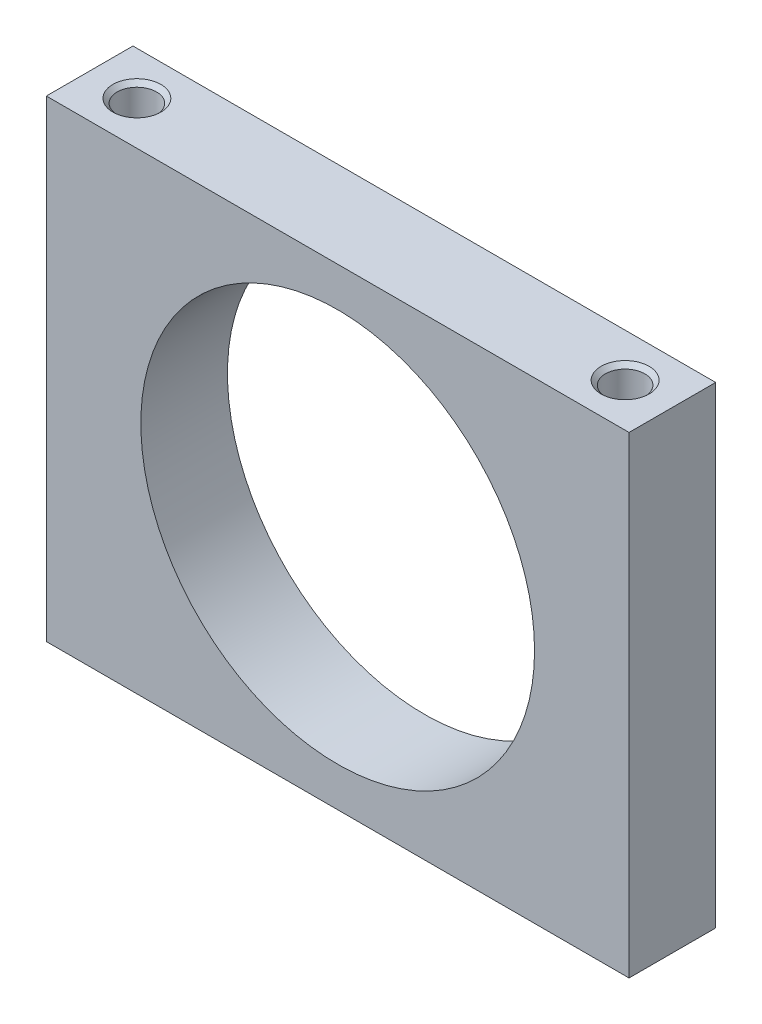
from build123d import *

# Parameters (mm, degrees)
SKETCH_1_W                   = 37
SKETCH_1_H                   = 30
SKETCH_1_R                   = 12.5
EXTRUDE_1_DEPTH              = 5.5
HOLE_WIZARD_M3_1_D           = 2.5
HOLE_WIZARD_M3_1_CSINK_D     = 3.05
HOLE_WIZARD_M3_1_CSINK_ANGLE = 90


with BuildPart() as part:
    # 草图1 → 凸台-拉伸1 (new body)
    with BuildSketch(Plane.XY):
        Rectangle(SKETCH_1_W, SKETCH_1_H)
        Circle(SKETCH_1_R, mode=Mode.SUBTRACT)
    extrude(amount=EXTRUDE_1_DEPTH)

    # M3 螺纹孔1 (through all)
    with Locations(Plane(origin=(0, 15, 0), x_dir=(1, 0, 0), z_dir=(0, 1, 0))):
        with Locations((-15.5, -2.75), (15.5, -2.75)):
            CounterSinkHole(HOLE_WIZARD_M3_1_D / 2, HOLE_WIZARD_M3_1_CSINK_D / 2, counter_sink_angle=HOLE_WIZARD_M3_1_CSINK_ANGLE)


solid = part.part
